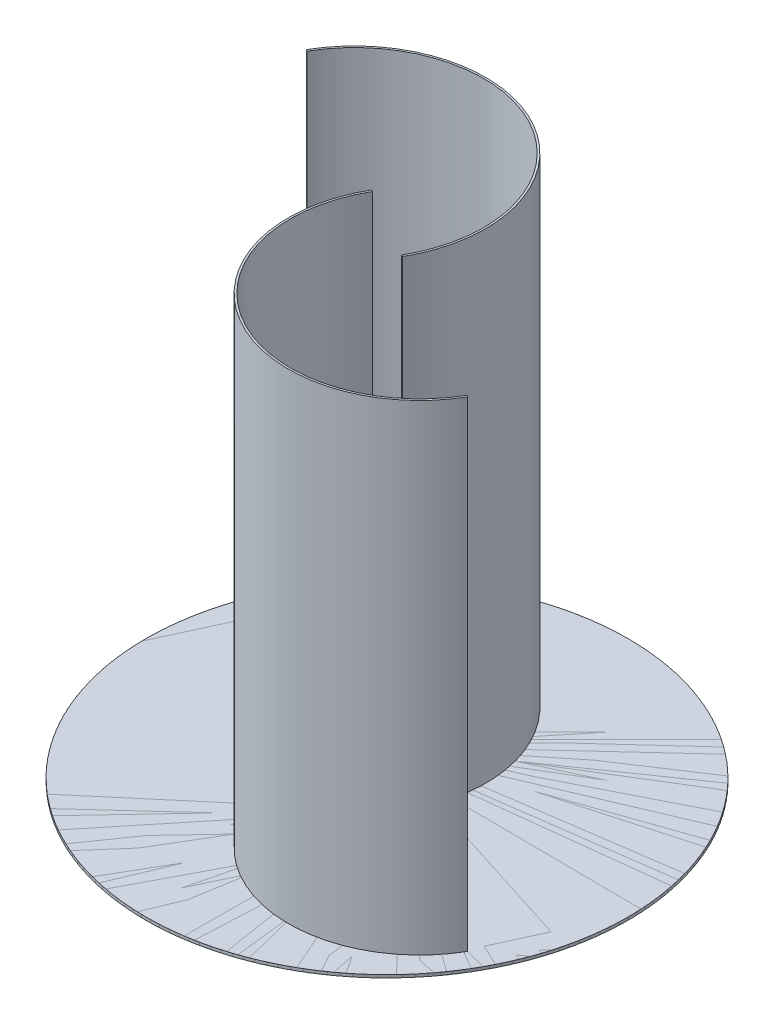
from build123d import *

# Parameters (mm, degrees)
CROQUIS1_R              = 250
SALIENTE_EXTRUIR1_DEPTH = 3
SALIENTE_EXTRUIR2_DEPTH = 498
MATRIZC1_COUNT          = 2


with BuildPart() as part:
    # Croquis1 → Saliente-Extruir1 (new body)
    with BuildSketch(Plane(origin=(0, 0, 0), x_dir=(1, 0, 0), z_dir=(0, 1, 0))):
        with Locations(Location((0, 0, 0), (0, 0, 270))):
            Circle(CROQUIS1_R)
    extrude(amount=SALIENTE_EXTRUIR1_DEPTH)

    # Croquis2 → Saliente-Extruir2 (add)
    with BuildSketch(Plane(origin=(0, 3, 0), x_dir=(1, 0, 0), z_dir=(0, 1, 0))):
        with BuildLine():
            Line((-197.689980809, 114.136363636), (-195.957930002, 113.136363636))
            ThreePointArc((-195.957930002, 113.136363636), (-12.910525895, 162.183767743), (36.136878212, -20.863636364))
            Line((36.136878212, -20.863636364), (37.86892902, -21.863636364))
            ThreePointArc((37.86892902, -21.863636364), (-11.910525895, 163.915818551), (-197.689980809, 114.136363636))
        make_face()
    extrude(amount=SALIENTE_EXTRUIR2_DEPTH)


with BuildPart() as matrizc1_1:
    # MatrizC1: pattern copy
    add(part.part.rotate(Axis((0, 0, 0), (0, 1, 0)), 1 * 360 / MATRIZC1_COUNT))


solid = Compound([part.part, matrizc1_1.part])
